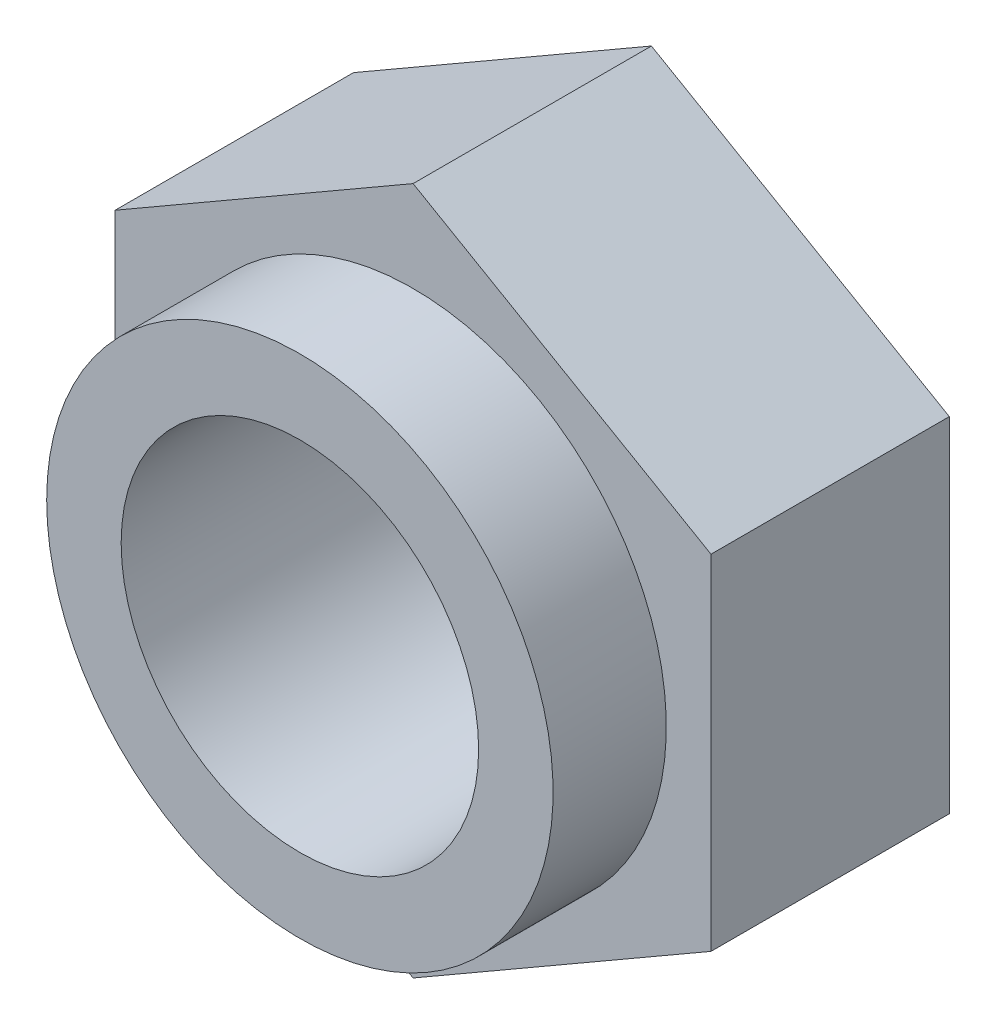
from build123d import *

# Parameters (mm, degrees)
EXTRUDE_1_DEPTH     = 4
SKETCH_2_R          = 4.25
EXTRUDE_2_DEPTH     = 1.9
SKETCH_3_R          = 3
CUT_EXTRUDE_1_DEPTH = 9.9


with BuildPart() as part:
    # 草图1 → 凸台-拉伸1 (new body)
    with BuildSketch(Plane.XY):
        Polygon((0, 5.773502692), (-5, 2.886751346), (-5, -2.886751346), (0, -5.773502692), (5, -2.886751346), (5, 2.886751346), align=None)
    extrude(amount=EXTRUDE_1_DEPTH)

    # 草图2 → 凸台-拉伸2 (add)
    with BuildSketch(Plane.XY.offset(4)):
        with Locations(Location((0, 0, 0), (0, 0, 180))):
            Circle(SKETCH_2_R)
    extrude(amount=EXTRUDE_2_DEPTH)

    # 草图3 → 切除-拉伸1 (cut)
    with BuildSketch(Plane.XY.offset(5.9)):
        Circle(SKETCH_3_R)
    extrude(amount=-CUT_EXTRUDE_1_DEPTH, mode=Mode.SUBTRACT)


solid = part.part
